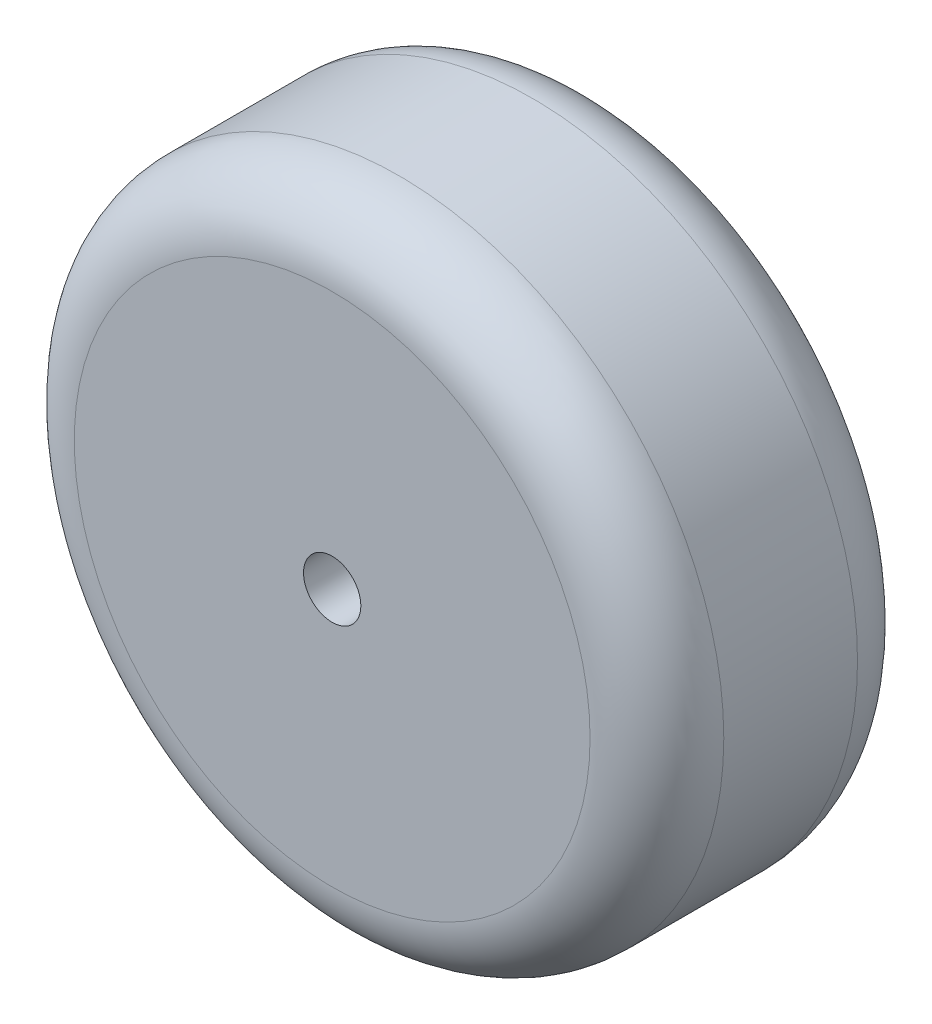
from build123d import *

# Parameters (mm, degrees)
ESBO_O1_R                = 34
ESBO_O1_R_2              = 3
RESSALTO_EXTRUS_O3_DEPTH = 28
FILETE2_R                = 7


with BuildPart() as part:
    # Esboço1 → Ressalto-extrusão3 (new body)
    with BuildSketch(Plane.XY):
        with Locations((-5.795635403, 6.532368717)):
            Circle(ESBO_O1_R)
        with Locations((-5.795635403, 6.532368717)):
            Circle(ESBO_O1_R_2, mode=Mode.SUBTRACT)
    extrude(amount=RESSALTO_EXTRUS_O3_DEPTH)

    # Filete2
    filete2_edges = [part.edges().sort_by_distance(p)[0] for p in [
        (-39.795635403, 6.532368717, 0),
        (-39.795635403, 6.532368717, 28),
    ]]
    fillet(filete2_edges, radius=FILETE2_R)


solid = part.part
